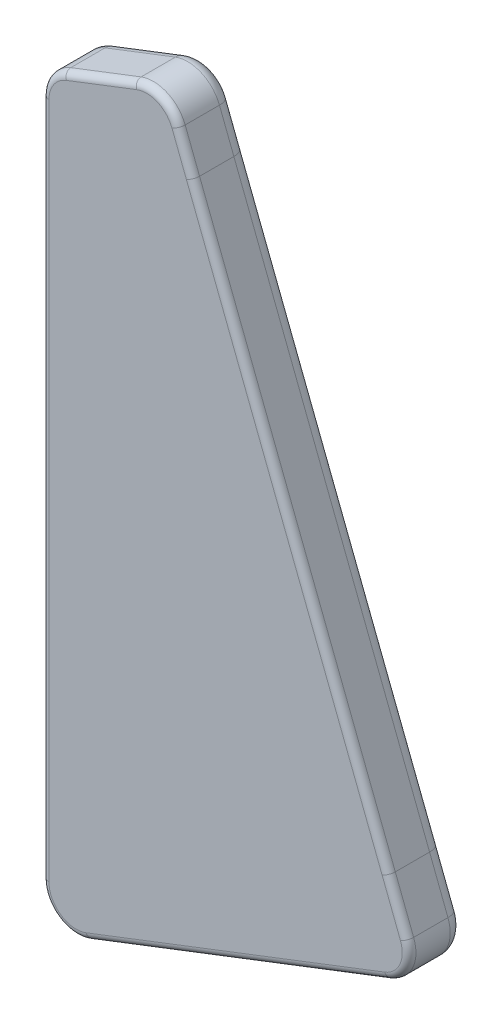
from build123d import *

# Parameters (mm, degrees)
BOSS_EXTRUDE1_DEPTH = 12.7
FILLET1_R           = 3.175
FILLET2_R           = 1.5875
SKETCH3_W           = 0.8128
SKETCH3_H           = 149.86
CUT_EXTRUDE1_DEPTH  = 6.35
CUT_EXTRUDE2_DEPTH  = 6.35


with BuildPart() as part:
    # Sketch1 → Boss-Extrude1 (new body)
    with BuildSketch(Plane.XY):
        with BuildLine():
            Line((73.075190052, 130.577903395), (27.7327817, 247.457923548))
            Line((27.7327817, 247.457923548), (24.400446704, 256.093871545))
            ThreePointArc((24.400446704, 256.093871545), (20.231049001, 260.472170453), (14.186914765, 260.619885912))
            Line((14.186914765, 260.619885912), (-2.107158786, 254.332526198))
            ThreePointArc((-2.107158786, 254.332526198), (-5.777404472, 251.431339634), (-7.1628, 246.962753045))
            Line((-7.1628, 246.962753045), (-7.1628, 243.84))
            Line((-7.1628, 243.84), (-7.1628, 238.76))
            Line((-7.1628, 238.76), (-7.1628, 99.06))
            Line((-7.1628, 99.06), (-7.1628, 93.98))
            Line((-7.1628, 93.98), (-7.1628, 90.008173247))
            ThreePointArc((-7.1628, 90.008173247), (-3.731986589, 83.494168775), (3.580358786, 82.638400094))
            Line((3.580358786, 82.638400094), (7.285888595, 84.068245047))
            Line((7.285888595, 84.068245047), (12.025292552, 85.897028832))
            Line((12.025292552, 85.897028832), (64.158736078, 106.01365047))
            Line((64.158736078, 106.01365047), (68.898140035, 107.842434255))
            Line((68.898140035, 107.842434255), (72.80002218, 109.34804527))
            ThreePointArc((72.80002218, 109.34804527), (77.178321088, 113.517442972), (77.326036547, 119.561577209))
            Line((77.326036547, 119.561577209), (73.075190052, 130.577903395))
        make_face()
    extrude(amount=BOSS_EXTRUDE1_DEPTH)

    # Fillet1
    fillet1_edges = [part.edges().sort_by_distance(p)[0] for p in [
        (-7.1628, 168.485463146, 0),
        (-3.731986589, 83.494168775, 0),
        (38.190190483, 95.993222682, 0),
        (77.178321088, 113.517442972, 0),
        (75.200613299, 125.069740302, 0),
        (50.403985876, 189.017913472, 0),
        (26.066614202, 251.775897547, 0),
        (20.231049001, 260.472170453, 0),
        (6.039877989, 257.476206055, 0),
        (-5.777404472, 251.431339634, 0),
    ]]
    fillet(fillet1_edges, radius=FILLET1_R)

    # Fillet2
    fillet2_edges = [part.edges().sort_by_distance(p)[0] for p in [
        (-5.777404472, 251.431339634, 12.7),
        (6.039877989, 257.476206055, 12.7),
        (20.231049001, 260.472170453, 12.7),
        (26.066614202, 251.775897547, 12.7),
        (50.403985876, 189.017913472, 12.7),
        (75.200613299, 125.069740302, 12.7),
        (77.178321088, 113.517442972, 12.7),
        (38.190190483, 95.993222682, 12.7),
        (-7.1628, 168.485463146, 12.7),
        (-3.731986589, 83.494168775, 12.7),
    ]]
    fillet(fillet2_edges, radius=FILLET2_R)

    # Sketch3 → Cut-Extrude1 (cut)
    with BuildSketch(Plane(origin=(0, 0, 0), x_dir=(-1, 0, 0), z_dir=(0, 0, -1))):
        with Locations((0.4064, 168.91)):
            Rectangle(SKETCH3_W, SKETCH3_H)
    extrude(amount=-CUT_EXTRUDE1_DEPTH, mode=Mode.SUBTRACT)

    # Sketch4 → Cut-Extrude2 (cut)
    with BuildSketch(Plane(origin=(0, 0, 0), x_dir=(-1, 0, 0), z_dir=(0, 0, -1))):
        Polygon((-66.319554898, 114.524993835), (-4.707303458, 90.750804626), (-4.999908864, 89.992499993), (-66.612160304, 113.766689202), align=None)
    extrude(amount=-CUT_EXTRUDE2_DEPTH, mode=Mode.SUBTRACT)


solid = part.part
